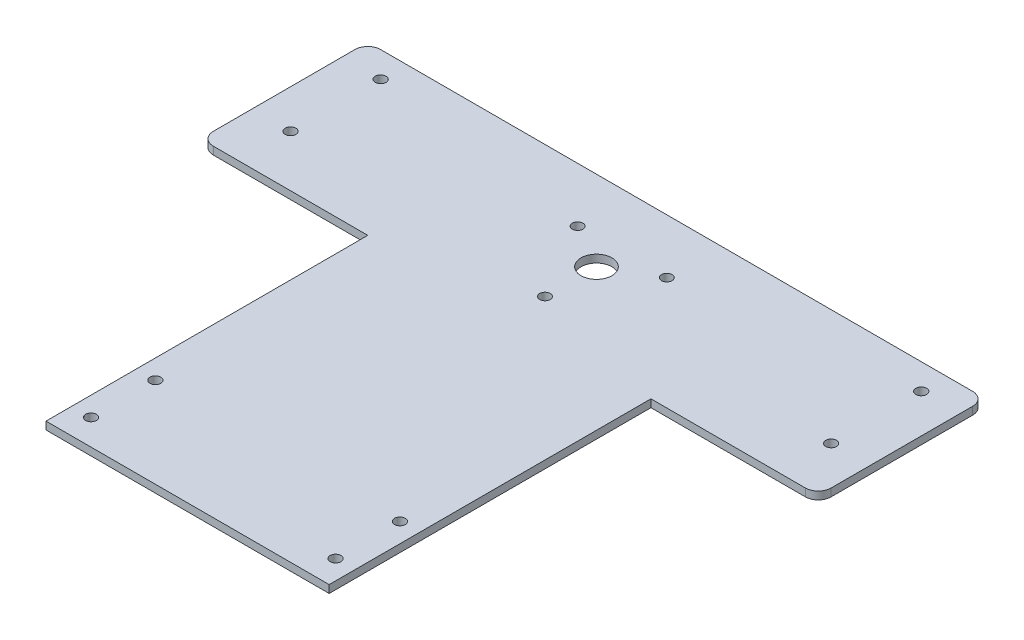
from build123d import *

# Parameters (mm, degrees)
SKETCH_1_W          = 240
SKETCH_1_H          = 65
SKETCH_1_R          = 2.1
EXTRUDE_1_DEPTH     = 3
FILLET_1_R          = 5
SKETCH_5_R          = 2.1
CUT_EXTRUDE_4_DEPTH = 10
SKETCH_3_R          = 6
SKETCH_3_R_2        = 2.05
CUT_EXTRUDE_5_DEPTH = 10


with BuildPart() as part:
    # 草图1 → 凸台-拉伸1 (new body)
    # profile 1 of 2: a face of its own
    with BuildSketch(Plane(origin=(0, 0, 0), x_dir=(1, 0, 0), z_dir=(0, 1, 0))):
        with Locations((0, 23.125)):
            Rectangle(SKETCH_1_W, SKETCH_1_H)
        with Locations(Location((105, 10.625, 0), (0, 0, 270))):
            Circle(SKETCH_1_R, mode=Mode.SUBTRACT)
        with Locations(Location((-105, 10.625, 0), (0, 0, 270))):
            Circle(SKETCH_1_R, mode=Mode.SUBTRACT)
        with Locations(Location((-105, 45.625, 0), (0, 0, 270))):
            Circle(SKETCH_1_R, mode=Mode.SUBTRACT)
        with Locations(Location((105, 45.625, 0), (0, 0, 270))):
            Circle(SKETCH_1_R, mode=Mode.SUBTRACT)
    # profile 2 of 2: a face of its own
    with BuildSketch(Plane(origin=(0, 0, 0), x_dir=(1, 0, 0), z_dir=(0, 1, 0))):
        Polygon((13.003862914, -9.375), (-55, -9.375), (-55, -134.375), (55, -134.375), (55, -9.375), align=None)
    extrude(amount=EXTRUDE_1_DEPTH)

    # 圆角1
    fillet_1_edges = [part.edges().sort_by_distance(p)[0] for p in [
        (-120, 1.5, 9.375),
        (-120, 1.5, -55.625),
        (120, 1.5, -55.625),
        (120, 1.5, 9.375),
    ]]
    fillet(fillet_1_edges, radius=FILLET_1_R)

    # 草图5 → 切除-拉伸4 (cut)
    with BuildSketch(Plane(origin=(0, 3, 0), x_dir=(1, 0, 0), z_dir=(0, 1, 0))):
        with Locations(Location((-47.5, -124.375, 0), (0, 0, 270))):
            Circle(SKETCH_5_R)
        with Locations(Location((47.5, -124.375, 0), (0, 0, 270))):
            Circle(SKETCH_5_R)
        with Locations(Location((47.5, -99.375, 0), (0, 0, 270))):
            Circle(SKETCH_5_R)
        with Locations(Location((-47.5, -99.375, 0), (0, 0, 270))):
            Circle(SKETCH_5_R)
    extrude(amount=-CUT_EXTRUDE_4_DEPTH, mode=Mode.SUBTRACT)

    # 草图3 → 切除-拉伸5 (cut)
    with BuildSketch(Plane(origin=(0, 3, 0), x_dir=(1, 0, 0), z_dir=(0, 1, 0))):
        with Locations(Location((0, 24.469725565, 0), (0, 0, 270))):
            Circle(SKETCH_3_R)
        with Locations(Location((0, 4.469725565, 0), (0, 0, 270))):
            Circle(SKETCH_3_R_2)
        with Locations(Location((-17.320508076, 34.469725565, 0), (0, 0, 270))):
            Circle(SKETCH_3_R_2)
        with Locations(Location((17.320508076, 34.469725565, 0), (0, 0, 270))):
            Circle(SKETCH_3_R_2)
    extrude(amount=-CUT_EXTRUDE_5_DEPTH, mode=Mode.SUBTRACT)


solid = part.part
